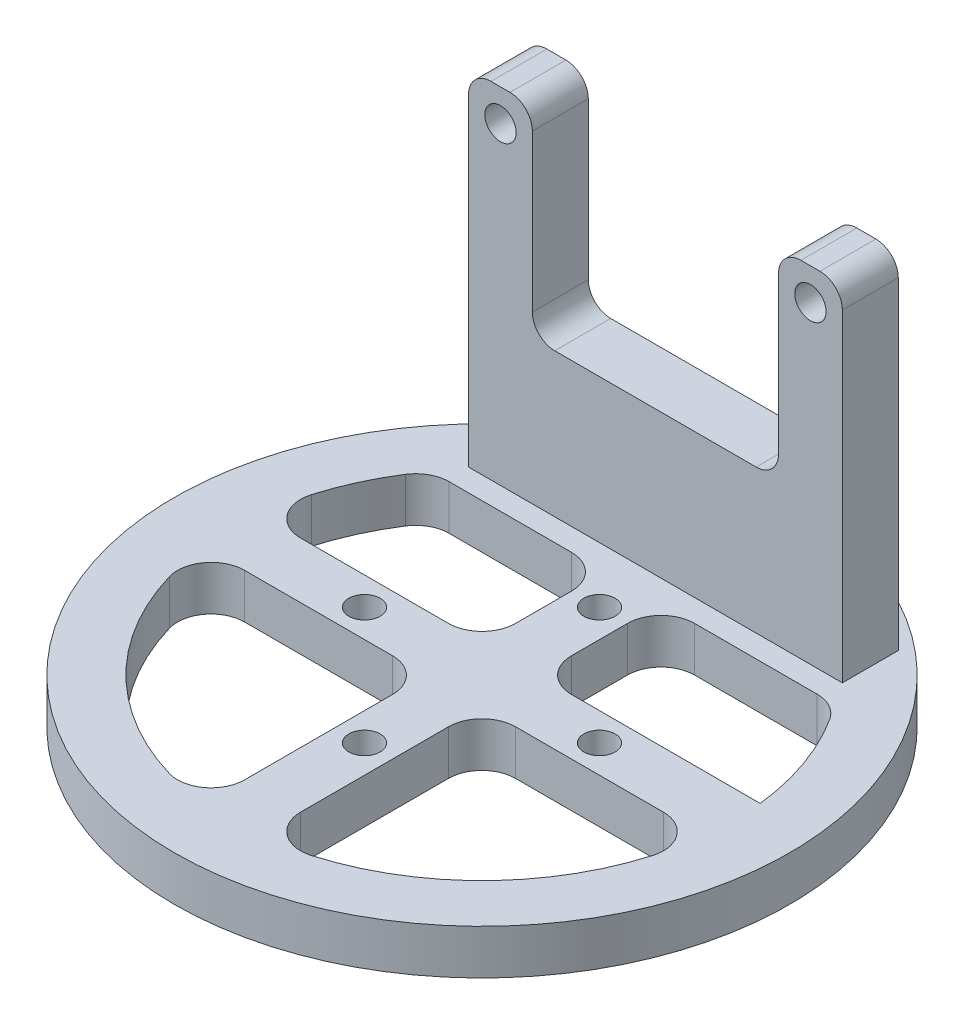
from build123d import *

# Parameters (mm, degrees)
SKETCH1_R           = 1.4
BOSS_EXTRUDE1_DEPTH = 2.5
SKETCH2_R           = 27.5
SKETCH2_R_2         = 1.4
BOSS_EXTRUDE2_DEPTH = 4
FILLET1_R           = 3
FILLET2_R           = 2


with BuildPart() as part:
    # Sketch1 → Boss-Extrude1 (new, symmetric)
    with BuildSketch(Plane.XY):
        Polygon((-16.7, 0), (16.7, 0), (16.7, 30.85), (11, 30.85), (11, 12.85), (-11, 12.85), (-11, 30.85), (-16.7, 30.85), align=None)
        with Locations((13.85, 28)):
            Circle(SKETCH1_R, mode=Mode.SUBTRACT)
        with Locations(Location((-13.85, 28, 0), (0, 0, 180))):
            Circle(SKETCH1_R, mode=Mode.SUBTRACT)
    extrude(amount=BOSS_EXTRUDE1_DEPTH, both=True)

    # Sketch2 → Boss-Extrude2 (add)
    with BuildSketch(Plane(origin=(0, 0, 0), x_dir=(1, 0, 0), z_dir=(0, 1, 0))):
        with Locations(Location((0, -18, 0), (0, 0, 270))):
            Circle(SKETCH2_R)
        with Locations(Location((0, -7.5, 0), (0, 0, 270))):
            Circle(SKETCH2_R_2, mode=Mode.SUBTRACT)
        with Locations(Location((10.5, -18, 0), (0, 0, 270))):
            Circle(SKETCH2_R_2, mode=Mode.SUBTRACT)
        with Locations(Location((0, -28.5, 0), (0, 0, 270))):
            Circle(SKETCH2_R_2, mode=Mode.SUBTRACT)
        with Locations(Location((-10.5, -18, 0), (0, 0, 270))):
            Circle(SKETCH2_R_2, mode=Mode.SUBTRACT)
        with BuildLine():
            Line((-18, -4.5), (-2.5, -4.5))
            Line((-2.5, -4.5), (-2.5, -15.5))
            Line((-2.5, -15.5), (-22.360679775, -15.5))
            ThreePointArc((-22.360679775, -15.5), (-20.916407865, -9.708203932), (-18, -4.5))
        make_face(mode=Mode.SUBTRACT)
        with BuildLine():
            Line((2.5, -4.5), (2.5, -15.5))
            Line((2.5, -15.5), (22.360679775, -15.5))
            ThreePointArc((22.360679775, -15.5), (20.916407865, -9.708203932), (18, -4.5))
            Line((18, -4.5), (2.5, -4.5))
        make_face(mode=Mode.SUBTRACT)
        with BuildLine():
            Line((-22.360679775, -20.5), (-2.5, -20.5))
            Line((-2.5, -20.5), (-2.5, -40.360679775))
            ThreePointArc((-2.5, -40.360679775), (-15.909902577, -33.909902577), (-22.360679775, -20.5))
        make_face(mode=Mode.SUBTRACT)
        with BuildLine():
            Line((2.5, -20.5), (2.5, -40.360679775))
            ThreePointArc((2.5, -40.360679775), (15.909902577, -33.909902577), (22.360679775, -20.5))
            Line((22.360679775, -20.5), (2.5, -20.5))
        make_face(mode=Mode.SUBTRACT)
    extrude(amount=-BOSS_EXTRUDE2_DEPTH)

    # Fillet1
    fillet1_edges = [part.edges().sort_by_distance(p)[0] for p in [
        (-18, -2, 4.5),
        (-22.360679775, -2, 15.5),
        (-2.5, -2, 15.5),
        (-22.360679775, -2, 20.5),
        (-2.5, -2, 40.360679775),
        (18, -2, 4.5),
        (2.5, -2, 4.5),
        (2.5, -2, 40.360679775),
        (22.360679775, -2, 20.5),
        (-2.5, -2, 4.5),
        (-2.5, -2, 20.5),
        (2.5, -2, 15.5),
        (2.5, -2, 20.5),
    ]]
    fillet(fillet1_edges, radius=FILLET1_R)

    # Fillet2
    fillet2_edges = [part.edges().sort_by_distance(p)[0] for p in [
        (-16.7, 30.85, 0),
        (-11, 30.85, 0),
        (-11, 12.85, 0),
        (11, 12.85, 0),
        (11, 30.85, 0),
        (16.7, 30.85, 0),
    ]]
    fillet(fillet2_edges, radius=FILLET2_R)


solid = part.part
